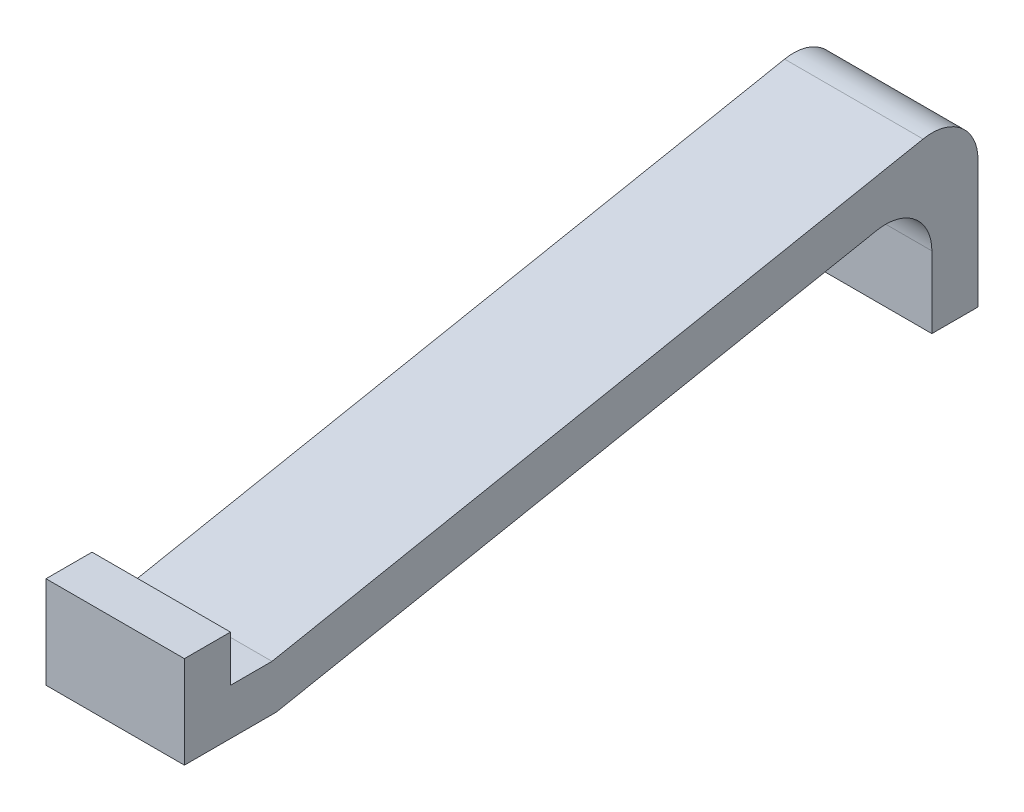
from build123d import *

# Parameters (mm, degrees)
SALIENTE_EXTRUIR1_DEPTH = 30


with BuildPart() as part:
    # Croquis2 → Saliente-Extruir1 (new body)
    with BuildSketch(Plane(origin=(0, 0, 0), x_dir=(0, 0, -1), z_dir=(1, 0, 0))):
        with BuildLine():
            Line((-102.260641265, 0), (-82.307345408, 0))
            Line((-82.307345408, 0), (47.828906849, 25.352631084))
            ThreePointArc((47.828906849, 25.352631084), (56.100280199, 23.254742154), (59.741117951, 15.537161217))
            Line((59.741117951, 15.537161217), (59.741117951, 0))
            Line((59.741117951, 0), (69.741117951, 0))
            Line((69.741117951, 0), (69.741117951, 27.673321039))
            ThreePointArc((69.741117951, 27.673321039), (66.100280199, 35.390901976), (57.828906849, 37.488790906))
            Line((57.828906849, 37.488790906), (-83.272354624, 10))
            Line((-83.272354624, 10), (-92.283993337, 10))
            Line((-92.283993337, 10), (-92.283993337, 20))
            Line((-92.283993337, 20), (-102.260641265, 20))
            Line((-102.260641265, 20), (-102.260641265, 0))
        make_face()
    extrude(amount=SALIENTE_EXTRUIR1_DEPTH)


solid = part.part
